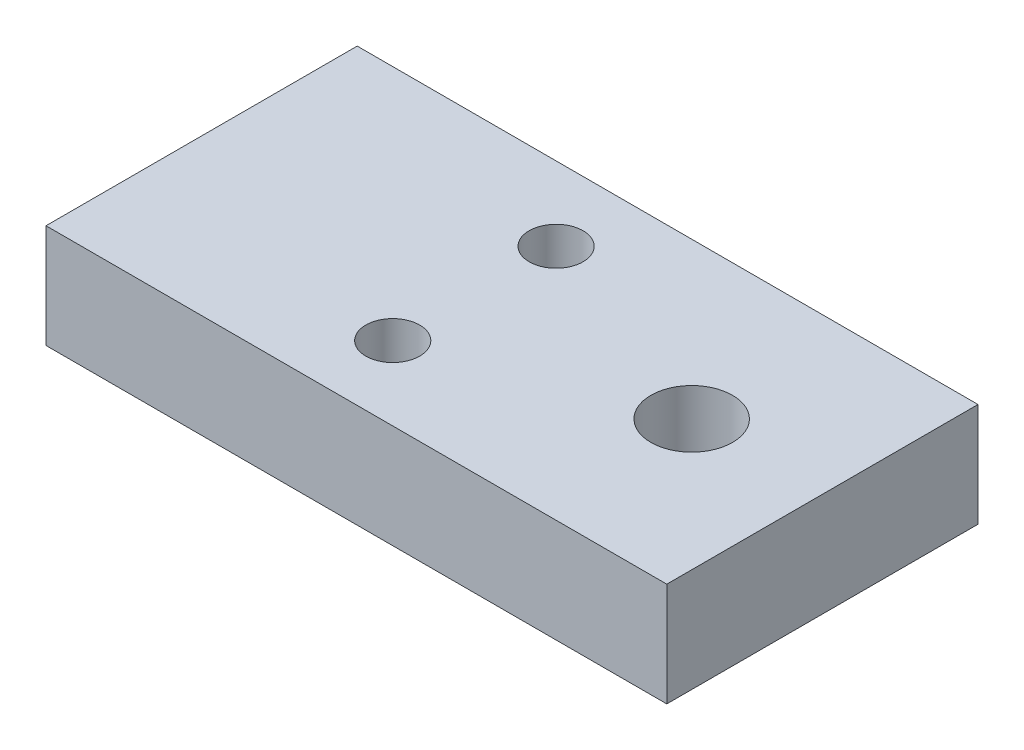
from build123d import *

# Parameters (mm, degrees)
SKETCH1_W             = 38
SKETCH1_H             = 19.05
BOSS_EXTRUDE1_DEPTH   = 6.35
M4X0_7_TAPPED_HOLE1_D = 3.3
M6X1_0_TAPPED_HOLE1_D = 5


with BuildPart() as part:
    # Sketch1 → Boss-Extrude1 (new body)
    with BuildSketch(Plane(origin=(0, 0, 0), x_dir=(1, 0, 0), z_dir=(0, 1, 0))):
        Rectangle(SKETCH1_W, SKETCH1_H)
    extrude(amount=BOSS_EXTRUDE1_DEPTH)

    # M4x0.7 Tapped Hole1 (through all)
    with Locations(Plane(origin=(-2.3, 6.35, -5), x_dir=(0, 0, 1), z_dir=(0, 1, 0))):
        with Locations((0, 0), (10, 0)):
            Hole(M4X0_7_TAPPED_HOLE1_D / 2)

    # M6x1.0 Tapped Hole1 (through all)
    with Locations(Plane(origin=(11, 6.35, 0), x_dir=(0, 0, 1), z_dir=(0, 1, 0))):
        with Locations((0, 0)):
            Hole(M6X1_0_TAPPED_HOLE1_D / 2)


solid = part.part
